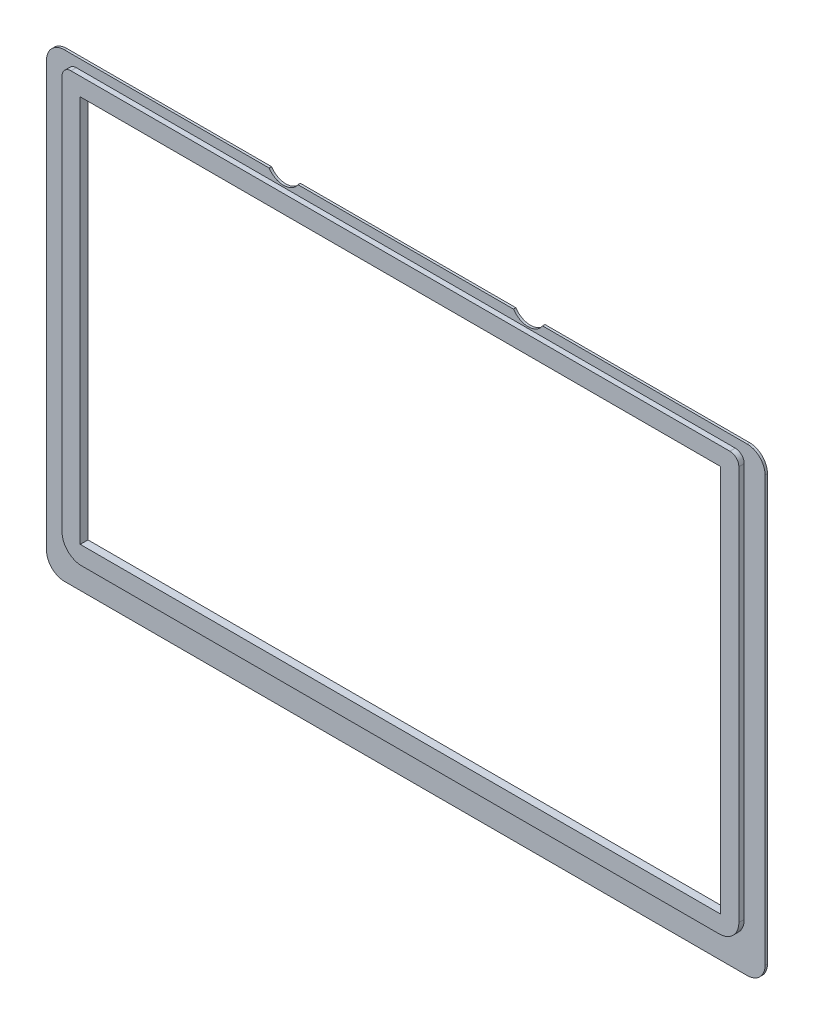
from build123d import *

# Parameters (mm, degrees)
SKIZZE2_W                       = 113.5
SKIZZE2_H                       = 71
AUFSATZ_LINEAR_AUSTRAGEN1_DEPTH = 1.3
AUFSATZ_LINEAR_START            = -0.9
SKIZZE3_W                       = 120.5
SKIZZE3_H                       = 77.2
AUFSATZ_LINEAR_AUSTRAGEN2_DEPTH = 0.4
SKIZZE4_W                       = 107.4
SKIZZE4_H                       = 65
SCHNITT_LINEAR_AUSTRAGEN1_DEPTH = 103.975737434
VERRUNDUNG1_R                   = 1.5
VERRUNDUNG2_R                   = 3.3
VERRUNDUNG3_R                   = 3
SKIZZE5_R                       = 2.9
SCHNITT_LINEAR_AUSTRAGEN2_DEPTH = 103.975737434


with BuildPart() as part:
    # Skizze2 → Aufsatz-Linear austragen1 (new body)
    with BuildSketch(Plane.XY.offset(19.9)):
        with Locations((0, 46.4)):
            Rectangle(SKIZZE2_W, SKIZZE2_H)
    extrude(amount=-AUFSATZ_LINEAR_AUSTRAGEN1_DEPTH)

    # Skizze3 → Aufsatz-Linear austragen2 (add)
    with BuildSketch(Plane.XY.offset(19.9).offset(AUFSATZ_LINEAR_START)):
        with Locations((0, 44.9)):
            Rectangle(SKIZZE3_W, SKIZZE3_H)
    extrude(amount=-AUFSATZ_LINEAR_AUSTRAGEN2_DEPTH)

    # Skizze4 → Schnitt-Linear austragen1 (cut, through all)
    with BuildSketch(Plane.XY.offset(19.9)):
        with Locations((0, 46.4)):
            Rectangle(SKIZZE4_W, SKIZZE4_H)
    extrude(amount=-SCHNITT_LINEAR_AUSTRAGEN1_DEPTH, mode=Mode.SUBTRACT)

    # Verrundung1
    verrundung1_edges = [part.edges().sort_by_distance(p)[0] for p in [
        (56.75, 81.9, 19.45),
        (-56.75, 81.9, 19.45),
    ]]
    fillet(verrundung1_edges, radius=VERRUNDUNG1_R)

    # Verrundung2
    verrundung2_edges = [part.edges().sort_by_distance(p)[0] for p in [
        (-56.75, 10.9, 19.45),
        (56.75, 10.9, 19.45),
    ]]
    fillet(verrundung2_edges, radius=VERRUNDUNG2_R)

    # Verrundung3
    verrundung3_edges = [part.edges().sort_by_distance(p)[0] for p in [
        (60.25, 83.5, 18.8),
        (60.25, 6.3, 18.8),
        (-60.25, 6.3, 18.8),
        (-60.25, 83.5, 18.8),
    ]]
    fillet(verrundung3_edges, radius=VERRUNDUNG3_R)

    # Skizze5 → Schnitt-Linear austragen2 (cut, through all)
    with BuildSketch(Plane.XY.offset(19.9)):
        with Locations((20.5, 85.070858308)):
            Circle(SKIZZE5_R)
        with Locations((-20.5, 85.1)):
            Circle(SKIZZE5_R)
    extrude(amount=-SCHNITT_LINEAR_AUSTRAGEN2_DEPTH, mode=Mode.SUBTRACT)


solid = part.part
